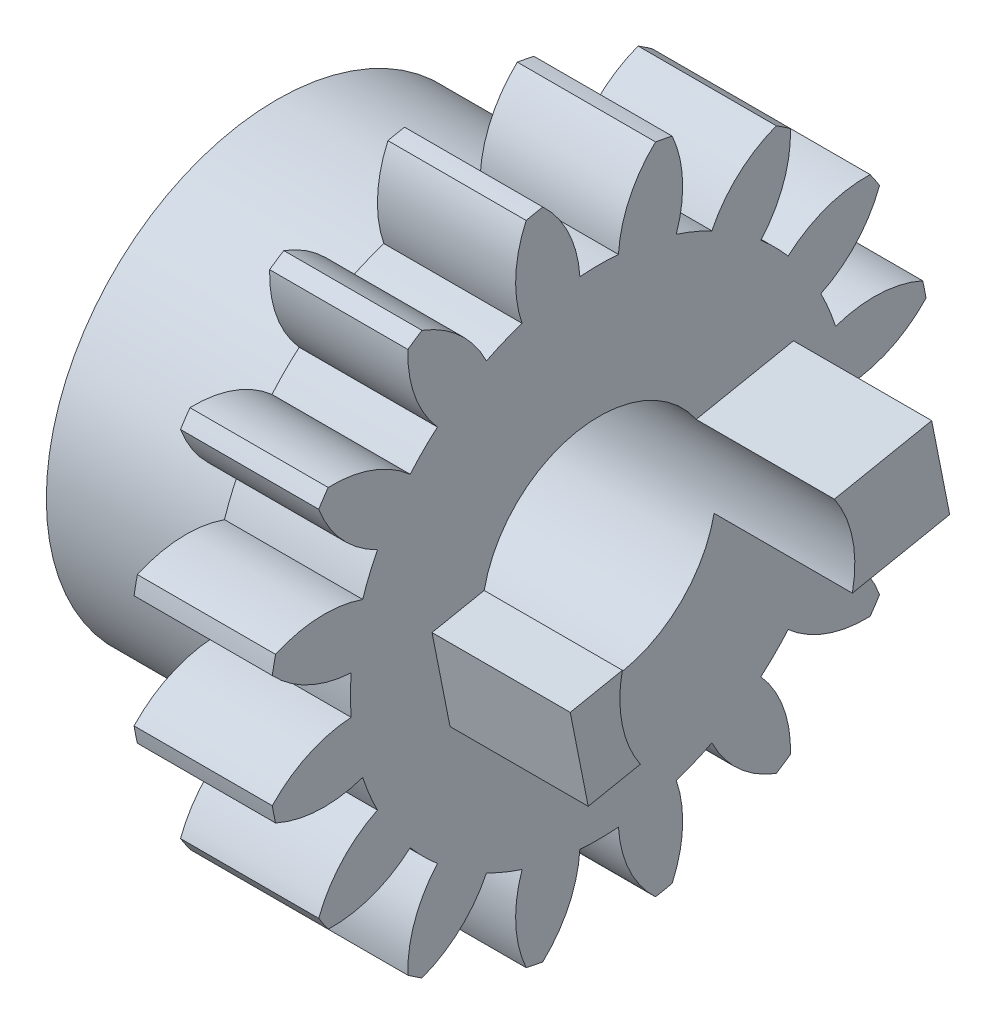
from build123d import *
from build123d.topology import SkipClean

# Parameters (mm, degrees)
BASPROSKE_W         = 3
BASPROSKE_H         = 7.2
TOOTHCUT_DEPTH      = 11.615083608
TEETHCUTS_COUNT     = 16
BORSKE_R            = 0.5
BORE_DEPTH          = 50.0000508
SKETCH_1_R          = 2.55
CUT_EXTRUDE_1_DEPTH = 11.473188484
EXTRUDE_START       = 4
SKETCH_3_R          = 5
SKETCH_3_R_2        = 2.55
EXTRUDE_2_DEPTH     = 4
EXTRUDE_1_DEPTH     = 3


with BuildPart() as part:
    # BasProSke → Base-Revolve (revolve)
    with BuildSketch(Plane(origin=(0, 0, 0), x_dir=(1, 0, 0), z_dir=(0, 1, 0))):
        with Locations((1.5, 3.6)):
            Rectangle(BASPROSKE_W, BASPROSKE_H)
    revolve(axis=Axis((-10, 0, 0), (1, 0, 0)))

    # TooCutSke → ToothCut (cut, through all)
    with BuildSketch(Plane(origin=(0, 0, 0), x_dir=(0, 0, -1), z_dir=(1, 0, 0))):
        with BuildLine():
            ThreePointArc((0.418431057, 5.382761043), (0, 5.399), (-0.418431057, 5.382761043))
            ThreePointArc((-0.418431057, 5.382761043), (-0.663605074, 6.330572066), (-1.246629414, 7.117044349))
            ThreePointArc((-1.246629414, 7.117044349), (0, 7.2254), (1.246629414, 7.117044349))
            ThreePointArc((1.246629414, 7.117044349), (0.663605074, 6.330572066), (0.418431057, 5.382761043))
        make_face()
    toothcut = extrude(amount=TOOTHCUT_DEPTH, mode=Mode.SUBTRACT)

    # TeethCuts: ToothCut ×16 about axis
    teethcuts_axis = Axis((-10, 0, 0), (1, 0, 0))
    for i in range(1, TEETHCUTS_COUNT):
        add(toothcut.rotate(teethcuts_axis, i * 360 / TEETHCUTS_COUNT), mode=Mode.SUBTRACT)

    # BorSke → Bore (cut, symmetric)
    with BuildSketch(Plane(origin=(0, 0, 0), x_dir=(0, 0, -1), z_dir=(1, 0, 0))):
        Circle(BORSKE_R)
    extrude(amount=BORE_DEPTH, both=True, mode=Mode.SUBTRACT)

    # 草图1 → 切除-拉伸1 (cut, through all)
    with BuildSketch(Plane(origin=(0, 0, 0), x_dir=(0, 0, -1), z_dir=(1, 0, 0))):
        Circle(SKETCH_1_R)
    extrude(amount=CUT_EXTRUDE_1_DEPTH, mode=Mode.SUBTRACT)

    # 草图3 → 凸台-拉伸2 (add)
    with SkipClean():  # the faces are left unmerged after this step: merging them gives an invalid solid
        with BuildSketch(Plane.ZY.offset(EXTRUDE_START)):
            Circle(SKETCH_3_R)
            Circle(SKETCH_3_R_2, mode=Mode.SUBTRACT)
        extrude(amount=-EXTRUDE_2_DEPTH)

    # 草图2 → 凸台-拉伸1 (add)
    with SkipClean():  # the faces are left unmerged after this step: merging them gives an invalid solid
        with BuildSketch(Plane(origin=(3, 0, 0), x_dir=(0, 0, -1), z_dir=(1, 0, 0))):
            with BuildLine():
                Line((4.608624084, -0.102878831), (4.21844344, 1.858691729))
                Line((4.21844344, 1.858691729), (2.105577747, 1.438416613))
                ThreePointArc((2.105577747, 1.438416613), (2.501002465, 0.497480321), (2.495758391, -0.523153948))
                Line((2.495758391, -0.523153948), (4.608624084, -0.102878831))
            make_face()
            with BuildLine():
                ThreePointArc((-2.105577747, -1.438416613), (-2.501002465, -0.497480321), (-2.495758391, 0.523153948))
                Line((-2.495758391, 0.523153948), (-3.627838803, 0.297969153))
                Line((-3.627838803, 0.297969153), (-3.237658159, -1.663601407))
                Line((-3.237658159, -1.663601407), (-2.105577747, -1.438416613))
            make_face()
        extrude(amount=EXTRUDE_1_DEPTH)


solid = part.part
